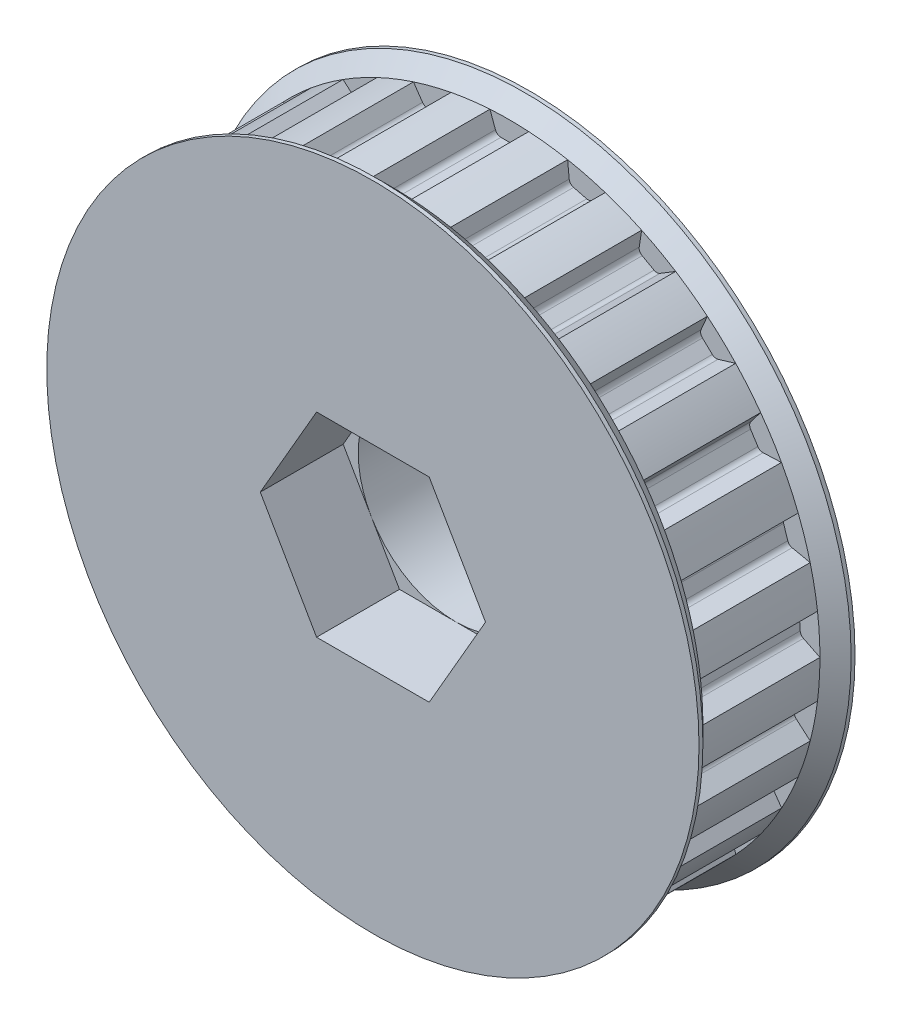
from build123d import *

# Parameters (mm, degrees)
SKETCH1_R          = 20.2184
BASEPULLEY_DEPTH   = 7.62
GROOVE_DEPTH       = 3.81
GROOVES_COUNT      = 25
SKETCH5_R          = 6.35
CUT_EXTRUDE1_DEPTH = 4.7625
CUT_EXTRUDE3_DEPTH = 31.511186358


with BuildPart() as part:
    # Sketch1 → BasePulley (new body)
    with BuildSketch(Plane.XY):
        Circle(SKETCH1_R)
    extrude(amount=-BASEPULLEY_DEPTH)

    # Sketch2 → Flange (revolve)
    with BuildSketch(Plane(origin=(0, 0, 0), x_dir=(0, 0, -1), z_dir=(1, 0, 0)), mode=Mode.PRIVATE) as flange_sk:
        Polygon((7.62, 20.2184), (8.636, 21.2344), (8.89, 21.2344), (8.89, 0), (-1.27, 0), (-1.27, 21.2344), (-1.016, 21.2344), (0, 20.2184), align=None)
    revolve(flange_sk.sketch.rotate(Axis((0, 0, 0), (0, 0, -1)), 90), axis=Axis((0, 0, 0), (0, 0, -1)))

    # Sketch3 → Groove (cut, symmetric)
    with BuildSketch(Plane.XY.offset(-3.81)):
        with BuildLine():
            Line((-1.2827, 20.2184), (-1.2827, 45.6184))
            Line((-1.2827, 45.6184), (1.2827, 45.6184))
            Line((1.2827, 45.6184), (1.2827, 20.2184))
            Line((1.2827, 20.2184), (0.659450384, 19.1389))
            ThreePointArc((0.659450384, 19.1389), (0.519994706, 18.999444321), (0.329494706, 18.9484))
            Line((0.329494706, 18.9484), (-0.55367873, 18.9484))
            ThreePointArc((-0.55367873, 18.9484), (-0.772211353, 19.017303071), (-0.911701619, 19.199090325))
            Line((-0.911701619, 19.199090325), (-1.2827, 20.2184))
        make_face()
    groove = extrude(amount=GROOVE_DEPTH, both=True, mode=Mode.SUBTRACT)

    # Grooves: Groove ×25 about axis
    grooves_axis = Axis((0, 0, 0), (0, 0, 1))
    for i in range(1, GROOVES_COUNT):
        add(groove.rotate(grooves_axis, i * 360 / GROOVES_COUNT), mode=Mode.SUBTRACT)

    # Sketch5 → Cut-Extrude1 (cut)
    with BuildSketch(Plane(origin=(0, 0, -8.89), x_dir=(-1, 0, 0), z_dir=(0, 0, -1))):
        Circle(SKETCH5_R)
    extrude(amount=-CUT_EXTRUDE1_DEPTH, mode=Mode.SUBTRACT)

    # Sketch6 → Cut-Extrude3 (cut, through all)
    with BuildSketch(Plane(origin=(0, 0, -4.1275), x_dir=(-1, 0, 0), z_dir=(0, 0, -1))):
        Polygon((3.666174209, 6.35), (-3.666174209, 6.35), (-7.332348419, 0), (-3.666174209, -6.35), (3.666174209, -6.35), (7.332348419, 0), align=None)
    extrude(amount=-CUT_EXTRUDE3_DEPTH, mode=Mode.SUBTRACT)


solid = part.part
